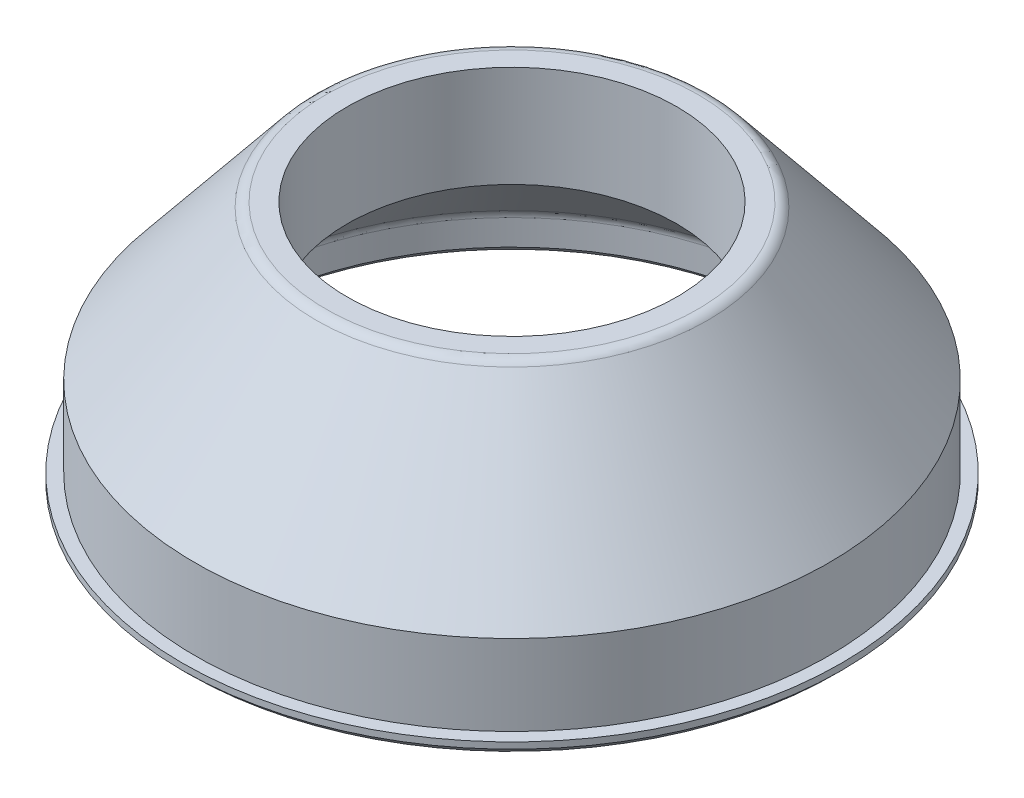
from build123d import *

# Parameters (mm, degrees)
FILLET1_R     = 1
CHAMFER1_SIZE = 0.5


with BuildPart() as part:
    # Sketch1 → Revolve1 (revolve)
    with BuildSketch(Plane.XY):
        Polygon((-26, 0), (-22.5, 0), (-22.5, 2.872417267), (-15.5, 11.5), (-13, 11.5), (-13, 19.5), (-15.142082361, 19.5), (-25, 7.35), (-25, 1), (-26, 1), align=None)
    revolve(axis=Axis((0, 0, 0), (0, 1, 0)))

    # Fillet1
    fillet1_edges = [part.edges().sort_by_distance(p)[0] for p in [
        (15.142082361, 19.5, 0),
        (22.5, 2.872417267, 0),
    ]]
    fillet(fillet1_edges, radius=FILLET1_R)

    # Chamfer1
    chamfer1_edges = [part.edges().sort_by_distance(p)[0] for p in [
        (22.5, 0, 0),
        (26, 0, 0),
    ]]
    chamfer(chamfer1_edges, length=CHAMFER1_SIZE)


solid = part.part
